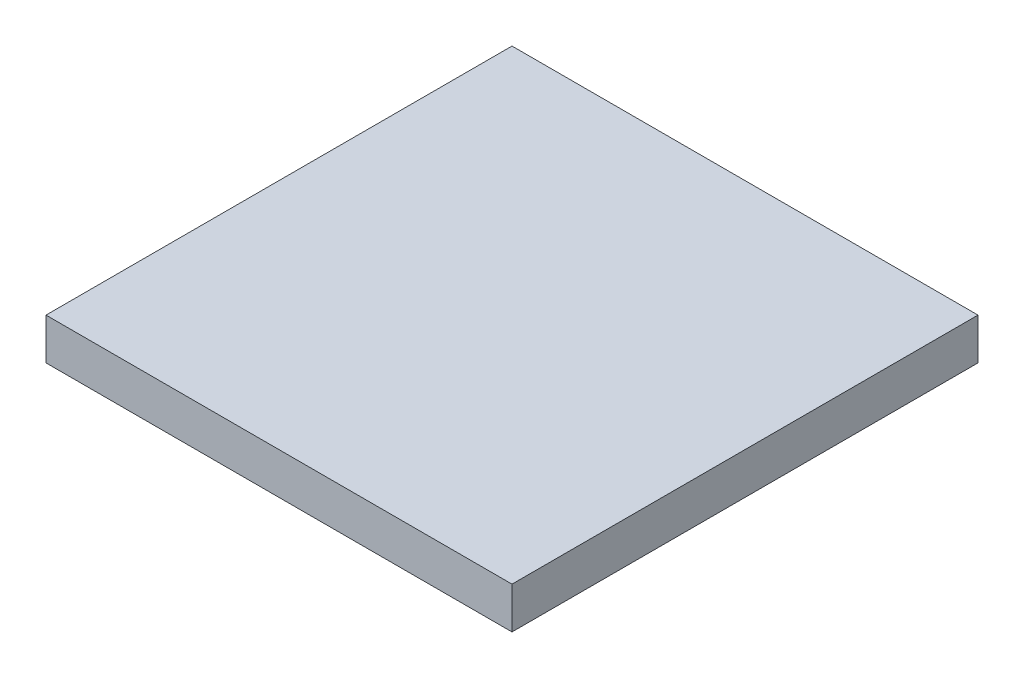
from build123d import *

# Parameters (mm, degrees)
SKETCH1_W           = 40
SKETCH1_H           = 40
BOSS_EXTRUDE1_DEPTH = 3.556


with BuildPart() as part:
    # Sketch1 → Boss-Extrude1 (new body)
    with BuildSketch(Plane(origin=(0, 0, 0), x_dir=(1, 0, 0), z_dir=(0, 1, 0))):
        with Locations((20, 20)):
            Rectangle(SKETCH1_W, SKETCH1_H)
    extrude(amount=BOSS_EXTRUDE1_DEPTH)


solid = part.part
